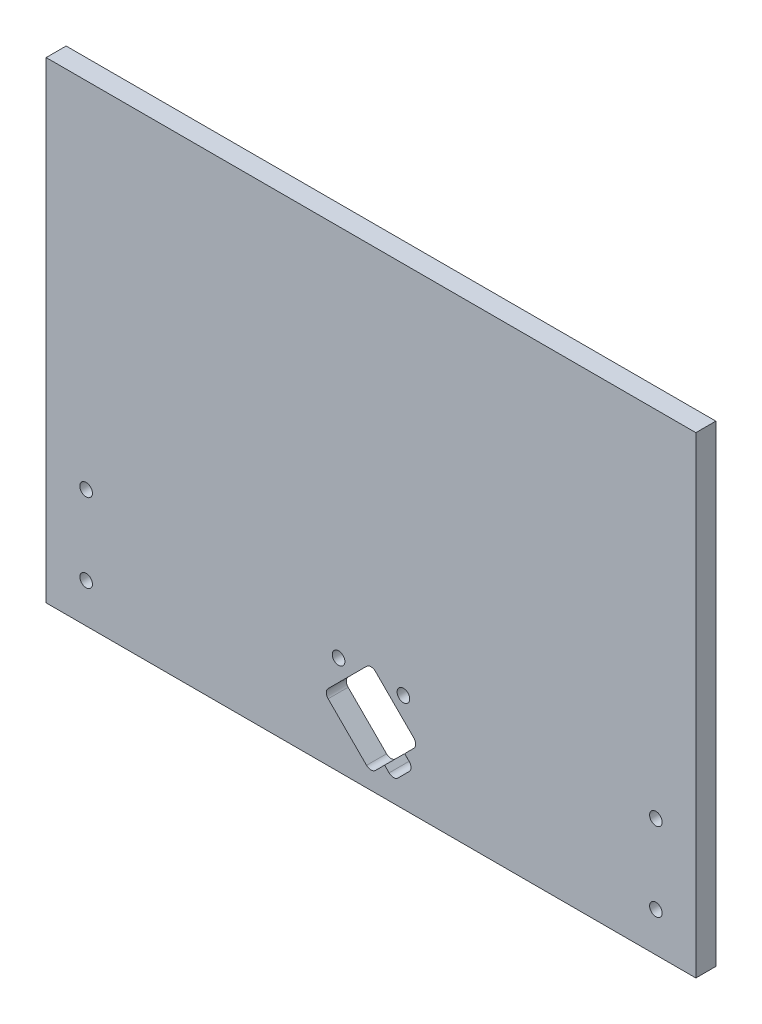
from build123d import *

# Parameters (mm, degrees)
SKETCH1_R           = 4
BOSS_EXTRUDE2_DEPTH = 12.7
CUT_EXTRUDE1_REACH  = 257.424
SKETCH2_R           = 4
FILLET1_R           = 4


with BuildPart() as part:
    # Sketch1 → Boss-Extrude2 (new body)
    with BuildSketch(Plane.XY):
        Polygon((-187.3, -150), (187.3, -150), (206.35, -150), (206.35, 150), (187.3, 150), (-187.3, 150), (-206.35, 150), (-206.35, -150), align=None)
        Polygon((14.318912319, -137.41311332), (8.66205807, -131.75625907), (0, -140.41831714), (-30.0520382, -110.366278939), (0, -80.314240739), (30.0520382, -110.366278939), (21.389980131, -119.028337009), (27.04683438, -124.685191258), align=None, mode=Mode.SUBTRACT)
        with Locations((-20.590065585, -87.466385575)):
            Circle(SKETCH1_R, mode=Mode.SUBTRACT)
        with Locations((20.590065585, -87.466385575)):
            Circle(SKETCH1_R, mode=Mode.SUBTRACT)
    extrude(amount=BOSS_EXTRUDE2_DEPTH)

    # Sketch2 → Cut-Extrude1 (cut, up to next)
    with BuildSketch(Plane.XY.offset(12.7), mode=Mode.PRIVATE) as cut_extrude1_sk1:
        with Locations((-180.95, -75)):
            Circle(SKETCH2_R)
    cut_extrude1_tool1 = extrude(cut_extrude1_sk1.sketch, amount=-CUT_EXTRUDE1_REACH, mode=Mode.PRIVATE) & part.part
    # Sketch2 → Cut-Extrude1 (cut, up to next)
    with BuildSketch(Plane.XY.offset(12.7), mode=Mode.PRIVATE) as cut_extrude1_sk2:
        with Locations((-180.95, -125)):
            Circle(SKETCH2_R)
    cut_extrude1_tool2 = extrude(cut_extrude1_sk2.sketch, amount=-CUT_EXTRUDE1_REACH, mode=Mode.PRIVATE) & part.part
    # Sketch2 → Cut-Extrude1 (cut, up to next)
    with BuildSketch(Plane.XY.offset(12.7), mode=Mode.PRIVATE) as cut_extrude1_sk3:
        with Locations((180.95, -125)):
            Circle(SKETCH2_R)
    cut_extrude1_tool3 = extrude(cut_extrude1_sk3.sketch, amount=-CUT_EXTRUDE1_REACH, mode=Mode.PRIVATE) & part.part
    # Sketch2 → Cut-Extrude1 (cut, up to next)
    with BuildSketch(Plane.XY.offset(12.7), mode=Mode.PRIVATE) as cut_extrude1_sk4:
        with Locations((180.95, -75)):
            Circle(SKETCH2_R)
    cut_extrude1_tool4 = extrude(cut_extrude1_sk4.sketch, amount=-CUT_EXTRUDE1_REACH, mode=Mode.PRIVATE) & part.part
    add(cut_extrude1_tool1.solids().sort_by_distance((-180.95, -75, 12.7))[0], mode=Mode.SUBTRACT)
    add(cut_extrude1_tool2.solids().sort_by_distance((-180.95, -125, 12.7))[0], mode=Mode.SUBTRACT)
    add(cut_extrude1_tool3.solids().sort_by_distance((180.95, -125, 12.7))[0], mode=Mode.SUBTRACT)
    add(cut_extrude1_tool4.solids().sort_by_distance((180.95, -75, 12.7))[0], mode=Mode.SUBTRACT)

    # Fillet1
    fillet1_edges = [part.edges().sort_by_distance(p)[0] for p in [
        (0, -80.314240739, 6.35),
        (-30.0520382, -110.366278939, 6.35),
        (0, -140.41831714, 6.35),
        (14.318912319, -137.41311332, 6.35),
        (27.04683438, -124.685191258, 6.35),
        (30.0520382, -110.366278939, 6.35),
    ]]
    fillet(fillet1_edges, radius=FILLET1_R)


solid = part.part
